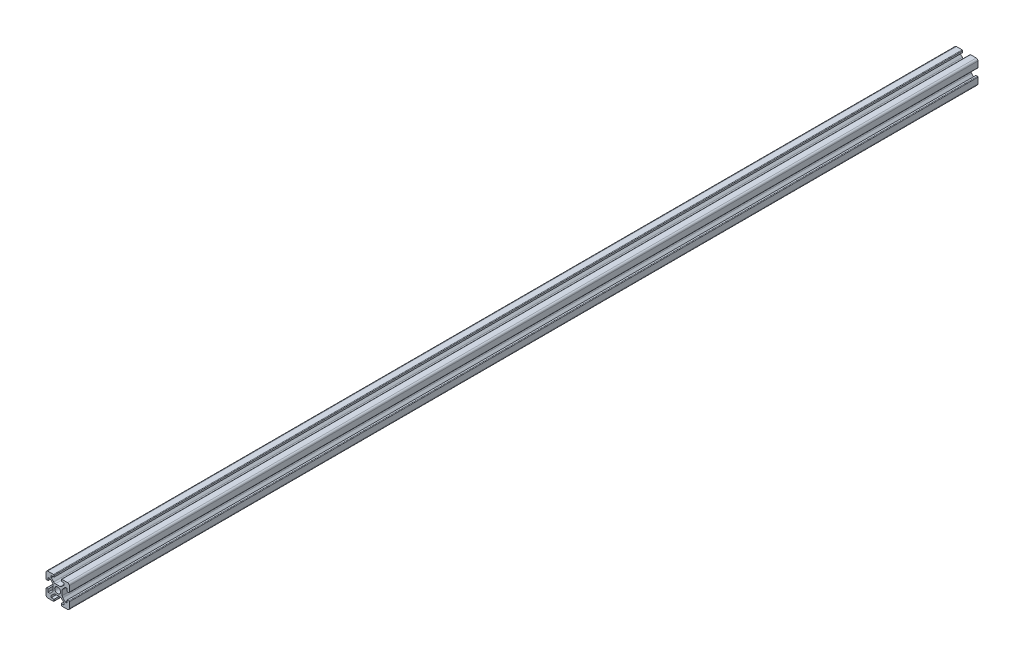
from build123d import *

# Parameters (mm, degrees)
SKETCH_1_R      = 2.5
EXTRUDE_1_DEPTH = 780


with BuildPart() as part:
    # 草图1 → 凸台-拉伸1 (new body)
    with BuildSketch(Plane.XY):
        with BuildLine():
            Line((3.9, 0), (3.9, 1.971572875))
            ThreePointArc((3.9, 1.971572875), (4.052240935, 2.73693974), (4.485786438, 3.385786438))
            Line((4.485786438, 3.385786438), (6.6, 5.5))
            Line((6.6, 5.5), (8.2, 5.5))
            Line((8.2, 5.5), (8.2, 3.1))
            Line((8.2, 3.1), (9.5, 3.1))
            ThreePointArc((9.5, 3.1), (9.853553391, 3.246446609), (10, 3.6))
            Line((10, 3.6), (10, 8.5))
            ThreePointArc((10, 8.5), (9.560660172, 9.560660172), (8.5, 10))
            Line((8.5, 10), (3.6, 10))
            ThreePointArc((3.6, 10), (3.246446609, 9.853553391), (3.1, 9.5))
            Line((3.1, 9.5), (3.1, 8.2))
            Line((3.1, 8.2), (5.5, 8.2))
            Line((5.5, 8.2), (5.5, 6.6))
            Line((5.5, 6.6), (3.385786438, 4.485786438))
            ThreePointArc((3.385786438, 4.485786438), (2.73693974, 4.052240935), (1.971572875, 3.9))
            Line((1.971572875, 3.9), (0, 3.9))
            Line((0, 3.9), (-1.971572875, 3.9))
            ThreePointArc((-1.971572875, 3.9), (-2.73693974, 4.052240935), (-3.385786438, 4.485786438))
            Line((-3.385786438, 4.485786438), (-5.5, 6.6))
            Line((-5.5, 6.6), (-5.5, 8.2))
            Line((-5.5, 8.2), (-3.1, 8.2))
            Line((-3.1, 8.2), (-3.1, 9.5))
            ThreePointArc((-3.1, 9.5), (-3.246446609, 9.853553391), (-3.6, 10))
            Line((-3.6, 10), (-8.5, 10))
            ThreePointArc((-8.5, 10), (-9.560660172, 9.560660172), (-10, 8.5))
            Line((-10, 8.5), (-10, 3.6))
            ThreePointArc((-10, 3.6), (-9.853553391, 3.246446609), (-9.5, 3.1))
            Line((-9.5, 3.1), (-8.2, 3.1))
            Line((-8.2, 3.1), (-8.2, 5.5))
            Line((-8.2, 5.5), (-6.6, 5.5))
            Line((-6.6, 5.5), (-4.485786438, 3.385786438))
            ThreePointArc((-4.485786438, 3.385786438), (-4.052240935, 2.73693974), (-3.9, 1.971572875))
            Line((-3.9, 1.971572875), (-3.9, 0))
            Line((-3.9, 0), (-3.9, -1.971572875))
            ThreePointArc((-3.9, -1.971572875), (-4.052240935, -2.73693974), (-4.485786438, -3.385786438))
            Line((-4.485786438, -3.385786438), (-6.6, -5.5))
            Line((-6.6, -5.5), (-8.2, -5.5))
            Line((-8.2, -5.5), (-8.2, -3.1))
            Line((-8.2, -3.1), (-9.5, -3.1))
            ThreePointArc((-9.5, -3.1), (-9.853553391, -3.246446609), (-10, -3.6))
            Line((-10, -3.6), (-10, -8.5))
            ThreePointArc((-10, -8.5), (-9.560660172, -9.560660172), (-8.5, -10))
            Line((-8.5, -10), (-3.6, -10))
            ThreePointArc((-3.6, -10), (-3.246446609, -9.853553391), (-3.1, -9.5))
            Line((-3.1, -9.5), (-3.1, -8.2))
            Line((-3.1, -8.2), (-5.5, -8.2))
            Line((-5.5, -8.2), (-5.5, -6.6))
            Line((-5.5, -6.6), (-3.385786438, -4.485786438))
            ThreePointArc((-3.385786438, -4.485786438), (-2.73693974, -4.052240935), (-1.971572875, -3.9))
            Line((-1.971572875, -3.9), (0, -3.9))
            Line((0, -3.9), (1.971572875, -3.9))
            ThreePointArc((1.971572875, -3.9), (2.73693974, -4.052240935), (3.385786438, -4.485786438))
            Line((3.385786438, -4.485786438), (5.5, -6.6))
            Line((5.5, -6.6), (5.5, -8.2))
            Line((5.5, -8.2), (3.1, -8.2))
            Line((3.1, -8.2), (3.1, -9.5))
            ThreePointArc((3.1, -9.5), (3.246446609, -9.853553391), (3.6, -10))
            Line((3.6, -10), (8.5, -10))
            ThreePointArc((8.5, -10), (9.560660172, -9.560660172), (10, -8.5))
            Line((10, -8.5), (10, -3.6))
            ThreePointArc((10, -3.6), (9.853553391, -3.246446609), (9.5, -3.1))
            Line((9.5, -3.1), (8.2, -3.1))
            Line((8.2, -3.1), (8.2, -5.5))
            Line((8.2, -5.5), (6.6, -5.5))
            Line((6.6, -5.5), (4.485786438, -3.385786438))
            ThreePointArc((4.485786438, -3.385786438), (4.052240935, -2.73693974), (3.9, -1.971572875))
            Line((3.9, -1.971572875), (3.9, 0))
        make_face()
        Circle(SKETCH_1_R, mode=Mode.SUBTRACT)
    extrude(amount=EXTRUDE_1_DEPTH)


solid = part.part
